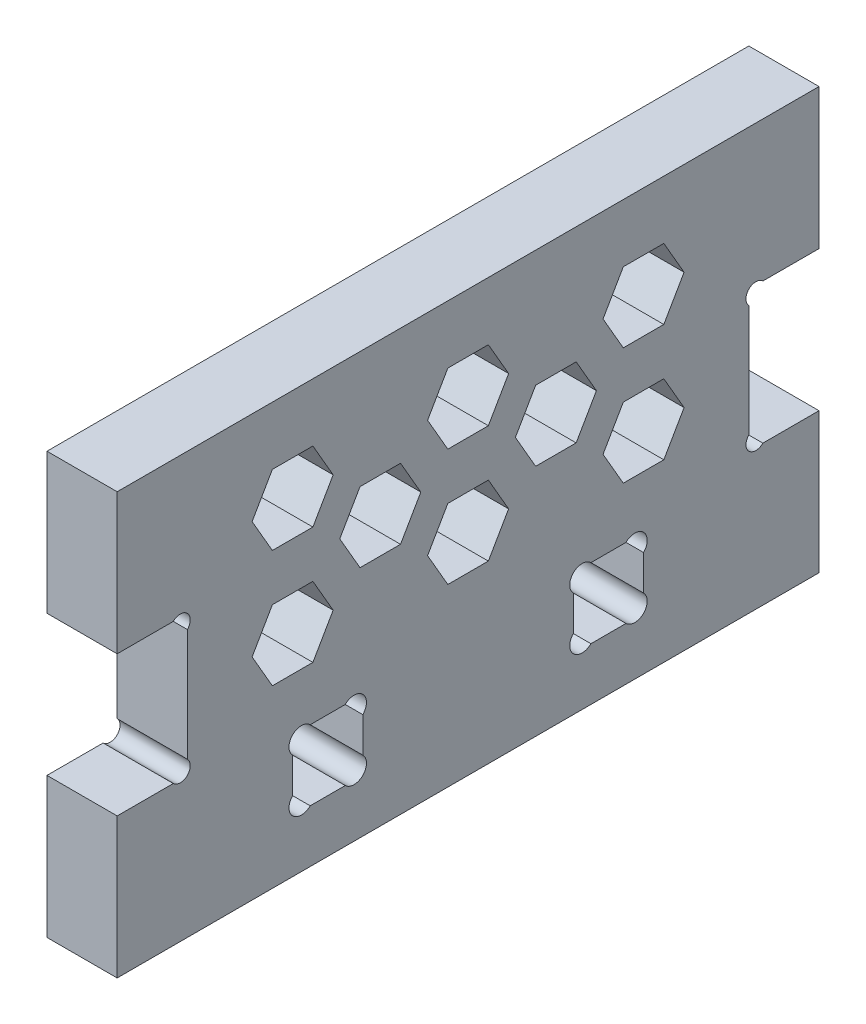
from build123d import *

# Parameters (mm, degrees)
SKETCH3_W                 = 101.6
SKETCH3_H                 = 76.2
SQUARE_EXTRUSION_DEPTH    = 12.7
SKETCH4_R                 = 2.24536
SKETCH4_W                 = 12.7
SKETCH4_H                 = 12.7
SLOTTING_HOLES_DEPTH      = 12.7
HONEYCOMB_POCKETING_DEPTH = 12.7
SKETCH14_W                = 12.7
SKETCH14_H                = 25.4
TAB_EXTRUSION_DEPTH       = 12.7
CUT_EXTRUDE2_START        = -12.7
SKETCH15_R                = 1.796051224
CUT_EXTRUDE2_DEPTH        = 12.7


with BuildPart() as part:
    # Sketch3 → Square Extrusion (new body)
    with BuildSketch(Plane(origin=(0, 0, 0), x_dir=(0, 0, -1), z_dir=(1, 0, 0))):
        Rectangle(SKETCH3_W, SKETCH3_H)
    extrude(amount=SQUARE_EXTRUSION_DEPTH)

    # Sketch4 → Slotting Holes (cut)
    with BuildSketch(Plane(origin=(12.7, 0, 0), x_dir=(0, 0, -1), z_dir=(1, 0, 0))):
        with BuildLine():
            ThreePointArc((-28.574581463, -15.875), (-31.750209282, -15.874790718), (-31.75, -19.050418537))
            Line((-31.75, -19.050418537), (-31.75, -15.875))
            Line((-31.75, -15.875), (-28.574581463, -15.875))
        make_face()
        with BuildLine():
            Line((-31.75, -15.875), (-31.75, -19.050418537))
            ThreePointArc((-31.75, -19.050418537), (-29.303101219, -19.536885515), (-27.91714, -17.4625))
            ThreePointArc((-27.91714, -17.4625), (-28.08800123, -16.603374641), (-28.574581463, -15.875))
            Line((-28.574581463, -15.875), (-31.75, -15.875))
        make_face()
        with Locations((-30.1625, -26.9875)):
            Circle(SKETCH4_R)
        with Locations((-20.6375, -26.9875)):
            Circle(SKETCH4_R)
        with Locations((-20.6375, -17.4625)):
            Circle(SKETCH4_R)
        with Locations((-30.1625, -17.4625)):
            Circle(SKETCH4_R)
        with Locations((-25.4, -22.225)):
            Rectangle(SKETCH4_W, SKETCH4_H)
        with BuildLine():
            ThreePointArc((-22.225418537, -15.875), (-22.225209282, -19.050209282), (-19.05, -19.050418537))
            Line((-19.05, -19.050418537), (-19.05, -15.875))
            Line((-19.05, -15.875), (-22.225418537, -15.875))
        make_face()
        with BuildLine():
            Line((-19.05, -15.875), (-19.05, -19.050418537))
            ThreePointArc((-19.05, -19.050418537), (-18.563114485, -18.321898781), (-18.39214, -17.4625))
            ThreePointArc((-18.39214, -17.4625), (-19.778374641, -15.38800123), (-22.225418537, -15.875))
            Line((-22.225418537, -15.875), (-19.05, -15.875))
        make_face()
        with BuildLine():
            Line((-31.75, -25.399581463), (-31.75, -28.575))
            Line((-31.75, -28.575), (-28.574581463, -28.575))
            ThreePointArc((-28.574581463, -28.575), (-28.08800123, -27.846625359), (-27.91714, -26.9875))
            ThreePointArc((-27.91714, -26.9875), (-29.303101219, -24.913114485), (-31.75, -25.399581463))
        make_face()
        with BuildLine():
            Line((-28.574581463, -28.575), (-31.75, -28.575))
            Line((-31.75, -28.575), (-31.75, -25.399581463))
            ThreePointArc((-31.75, -25.399581463), (-31.750209282, -28.575209282), (-28.574581463, -28.575))
        make_face()
        with BuildLine():
            ThreePointArc((-19.05, -25.399581463), (-22.225209282, -25.399790718), (-22.225418537, -28.575))
            Line((-22.225418537, -28.575), (-19.05, -28.575))
            Line((-19.05, -28.575), (-19.05, -25.399581463))
        make_face()
        with BuildLine():
            Line((-19.05, -28.575), (-22.225418537, -28.575))
            ThreePointArc((-22.225418537, -28.575), (-19.778374641, -29.06199877), (-18.39214, -26.9875))
            ThreePointArc((-18.39214, -26.9875), (-18.563114485, -26.128101219), (-19.05, -25.399581463))
            Line((-19.05, -25.399581463), (-19.05, -28.575))
        make_face()
        with BuildLine():
            ThreePointArc((22.88286, -17.4625), (22.71199877, -16.603374641), (22.225418537, -15.875))
            Line((22.225418537, -15.875), (19.05, -15.875))
            Line((19.05, -15.875), (19.05, -19.050418537))
            ThreePointArc((19.05, -19.050418537), (21.496898781, -19.536885515), (22.88286, -17.4625))
        make_face()
        with BuildLine():
            Line((19.05, -15.875), (22.225418537, -15.875))
            ThreePointArc((22.225418537, -15.875), (19.049790718, -15.874790718), (19.05, -19.050418537))
            Line((19.05, -19.050418537), (19.05, -15.875))
        make_face()
        with Locations((30.1625, -17.4625)):
            Circle(SKETCH4_R)
        with Locations((20.6375, -17.4625)):
            Circle(SKETCH4_R)
        with Locations((20.6375, -26.9875)):
            Circle(SKETCH4_R)
        with Locations((30.1625, -26.9875)):
            Circle(SKETCH4_R)
        with Locations((25.4, -22.225)):
            Rectangle(SKETCH4_W, SKETCH4_H)
        with BuildLine():
            Line((31.75, -19.050418537), (31.75, -15.875))
            Line((31.75, -15.875), (28.574581463, -15.875))
            ThreePointArc((28.574581463, -15.875), (28.574790718, -19.050209282), (31.75, -19.050418537))
        make_face()
        with BuildLine():
            Line((28.574581463, -15.875), (31.75, -15.875))
            Line((31.75, -15.875), (31.75, -19.050418537))
            ThreePointArc((31.75, -19.050418537), (32.236885515, -18.321898781), (32.40786, -17.4625))
            ThreePointArc((32.40786, -17.4625), (31.021625359, -15.38800123), (28.574581463, -15.875))
        make_face()
        with BuildLine():
            ThreePointArc((32.40786, -26.9875), (32.236885515, -26.128101219), (31.75, -25.399581463))
            Line((31.75, -25.399581463), (31.75, -28.575))
            Line((31.75, -28.575), (28.574581463, -28.575))
            ThreePointArc((28.574581463, -28.575), (31.021625359, -29.06199877), (32.40786, -26.9875))
        make_face()
        with BuildLine():
            Line((31.75, -28.575), (31.75, -25.399581463))
            ThreePointArc((31.75, -25.399581463), (28.574790718, -25.399790718), (28.574581463, -28.575))
            Line((28.574581463, -28.575), (31.75, -28.575))
        make_face()
        with BuildLine():
            ThreePointArc((22.88286, -26.9875), (21.496898781, -24.913114485), (19.05, -25.399581463))
            Line((19.05, -25.399581463), (19.05, -28.575))
            Line((19.05, -28.575), (22.225418537, -28.575))
            ThreePointArc((22.225418537, -28.575), (22.71199877, -27.846625359), (22.88286, -26.9875))
        make_face()
        with BuildLine():
            Line((19.05, -28.575), (19.05, -25.399581463))
            ThreePointArc((19.05, -25.399581463), (19.049790718, -28.575209282), (22.225418537, -28.575))
            Line((22.225418537, -28.575), (19.05, -28.575))
        make_face()
    extrude(amount=-SLOTTING_HOLES_DEPTH, mode=Mode.SUBTRACT)

    # Sketch9 → Honeycomb Pocketing (cut)
    with BuildSketch(Plane(origin=(12.7, 0, 0), x_dir=(0, 0, -1), z_dir=(1, 0, 0))):
        Polygon((-35.416174209, 14.85738686), (-28.083825791, 14.85738686), (-24.417651581, 21.20738686), (-28.083825791, 27.55738686), (-35.416174209, 27.55738686), (-39.082348419, 21.20738686), align=None)
        Polygon((-3.666174209, -6.35), (3.666174209, -6.35), (7.332348419, 0), (3.666174209, 6.35), (-3.666174209, 6.35), (-7.332348419, 0), align=None)
        Polygon((-35.416174209, -6.35), (-28.083825791, -6.35), (-24.417651581, 0), (-28.083825791, 6.35), (-35.416174209, 6.35), (-39.082348419, 0), align=None)
        Polygon((28.083825791, -6.35), (35.416174209, -6.35), (39.082348419, 0), (35.416174209, 6.35), (28.083825791, 6.35), (24.417651581, 0), align=None)
        Polygon((-3.666174209, 14.85738686), (3.666174209, 14.85738686), (7.332348419, 21.20738686), (3.666174209, 27.55738686), (-3.666174209, 27.55738686), (-7.332348419, 21.20738686), align=None)
        Polygon((28.083825791, 14.85738686), (35.416174209, 14.85738686), (39.082348419, 21.20738686), (35.416174209, 27.55738686), (28.083825791, 27.55738686), (24.417651581, 21.20738686), align=None)
        Polygon((19.556437025, 4.227257458), (12.224088606, 4.227257458), (8.557914397, 10.577257458), (12.224088606, 16.927257458), (19.556437025, 16.927257458), (23.222611234, 10.577257458), align=None)
        Polygon((-12.224088606, 4.227257458), (-8.557914397, 10.577257458), (-12.224088606, 16.927257458), (-19.556437025, 16.927257458), (-23.222611234, 10.577257458), (-19.556437025, 4.227257458), align=None)
    extrude(amount=-HONEYCOMB_POCKETING_DEPTH, mode=Mode.SUBTRACT)

    # Sketch14 → Tab Extrusion (add)
    with BuildSketch(Plane(origin=(12.7, 0, 0), x_dir=(0, 0, -1), z_dir=(1, 0, 0))):
        with Locations((-57.15, 25.4)):
            Rectangle(SKETCH14_W, SKETCH14_H)
        with Locations((-57.15, -25.4)):
            Rectangle(SKETCH14_W, SKETCH14_H)
        with Locations((57.15, -25.4)):
            Rectangle(SKETCH14_W, SKETCH14_H)
        with Locations((57.15, 25.4)):
            Rectangle(SKETCH14_W, SKETCH14_H)
    extrude(amount=-TAB_EXTRUSION_DEPTH)

    # Sketch15 → Cut-Extrude2 (cut)
    with BuildSketch(Plane(origin=(12.7, 0, 0), x_dir=(0, 0, -1), z_dir=(1, 0, 0)).offset(CUT_EXTRUDE2_START)):
        with Locations((-52.07, 11.43)):
            Circle(SKETCH15_R)
        with Locations((-52.07, -11.43)):
            Circle(SKETCH15_R)
        with Locations((52.07, -11.43)):
            Circle(SKETCH15_R)
        with Locations((52.07, 11.43)):
            Circle(SKETCH15_R)
    extrude(amount=CUT_EXTRUDE2_DEPTH, mode=Mode.SUBTRACT)


solid = part.part
